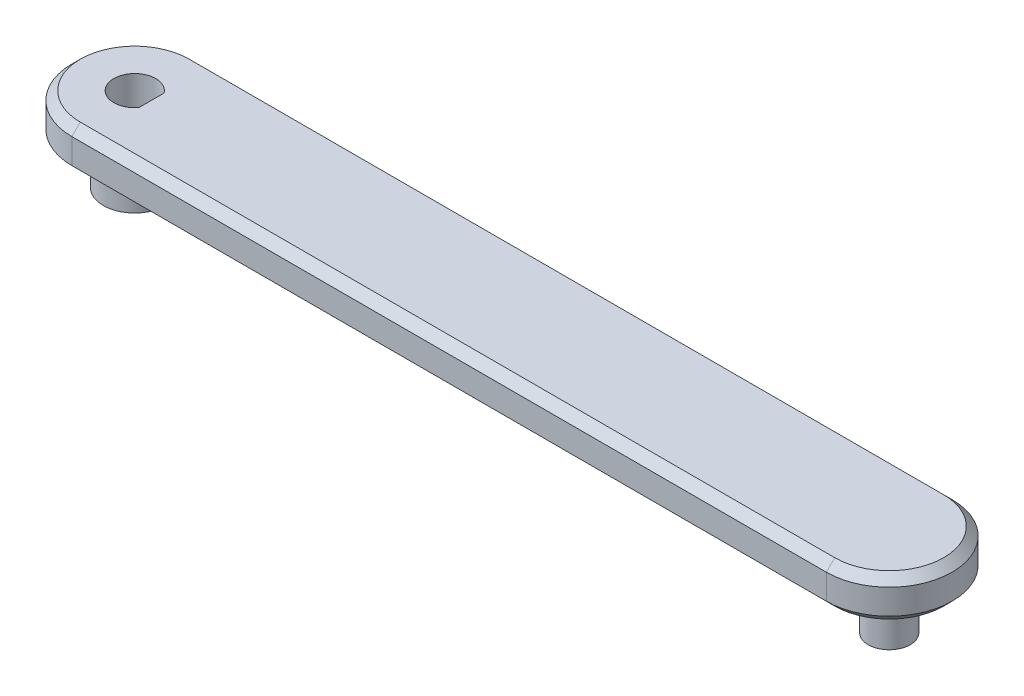
from build123d import *

# Parameters (mm, degrees)
EXTRUDE_2_DEPTH          = 10
CHAMFER_1_SIZE           = 2
SKETCH_9_R               = 7.5
EXTRUDE_7_DEPTH          = 10
CUT_EXTRUDE_3_DEPTH      = 10
CUT_EXTRUDE_3_DEPTH_BACK = 196.831560276
SKETCH_11_R              = 5
EXTRUDE_8_DEPTH          = 12


with BuildPart() as part:
    # 草图1 → 凸台-拉伸2 (new body)
    with BuildSketch(Plane(origin=(0, 0, 0), x_dir=(1, 0, 0), z_dir=(0, 1, 0))):
        with BuildLine():
            Line((0, 15), (180, 15))
            ThreePointArc((180, 15), (195, 0), (180, -15))
            Line((180, -15), (0, -15))
            ThreePointArc((0, -15), (-15, 0), (0, 15))
        make_face()
    extrude(amount=EXTRUDE_2_DEPTH)

    # 倒角1
    chamfer_1_edges = [part.edges().sort_by_distance(p)[0] for p in [
        (-15, 10, 0),
        (90, 10, 15),
        (90, 10, -15),
        (195, 10, 0),
        (195, 0, 0),
        (90, 0, 15),
        (-15, 0, 0),
        (90, 0, -15),
    ]]
    chamfer(chamfer_1_edges, length=CHAMFER_1_SIZE)

    # 草图9 → 凸台-拉伸7 (add)
    with BuildSketch(Plane.XZ):
        Circle(SKETCH_9_R)
    extrude(amount=EXTRUDE_7_DEPTH)

    # 草图4 → 切除-拉伸3 (cut, two sides: drawn at the far end of the back side and taken through both)
    with BuildSketch(Plane.XZ.offset(-CUT_EXTRUDE_3_DEPTH_BACK)):
        with BuildLine():
            Line((4, 3), (4, -3))
            ThreePointArc((4, -3), (-5, 0), (4, 3))
        make_face()
    extrude(amount=CUT_EXTRUDE_3_DEPTH + CUT_EXTRUDE_3_DEPTH_BACK, mode=Mode.SUBTRACT)

    # 草图11 → 凸台-拉伸8 (add)
    with BuildSketch(Plane.XZ):
        with Locations((180, 0)):
            Circle(SKETCH_11_R)
    extrude(amount=EXTRUDE_8_DEPTH)


solid = part.part
